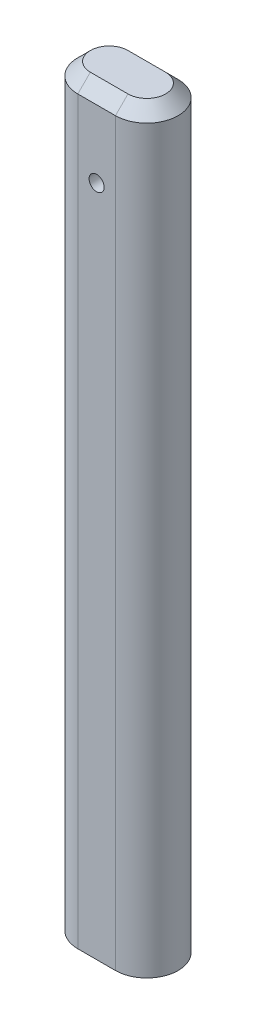
from build123d import *

# Parameters (mm, degrees)
SKETCH1_W           = 40
SKETCH1_H           = 25
BOSS_EXTRUDE1_DEPTH = 300
FILLET1_RADIUS      = 12.5
FILLET1_LENGTH      = 300
FILLET2_RADIUS      = 12.5
FILLET2_LENGTH      = 300
CHAMFER1_SIZE       = 5
SKETCH3_R           = 3
CUT_EXTRUDE2_DEPTH  = 304.685692781


with BuildPart() as part:
    # Sketch1 → Boss-Extrude1 (new body)
    with BuildSketch(Plane(origin=(0, 0, 0), x_dir=(1, 0, 0), z_dir=(0, 1, 0))):
        with Locations((20, 12.5)):
            Rectangle(SKETCH1_W, SKETCH1_H)
    extrude(amount=BOSS_EXTRUDE1_DEPTH)

    # Fillet1: full round fillet: the end face becomes a half cylinder, R = half its width
    fillet1_face = Plane((40, 150, -12.5), x_dir=(0, 1, 0), z_dir=(1, 0, 0))  # on the end face: x along it, z out of the body
    fillet1_slab = fillet1_face.offset(-FILLET1_RADIUS / 2) * Box(FILLET1_LENGTH, 2 * FILLET1_RADIUS, FILLET1_RADIUS, mode=Mode.PRIVATE)  # the body's end, R deep
    fillet1_round = Plane((27.5, 150, -12.5), x_dir=(1, 0, 0), z_dir=(0, 1, 0)) * Cylinder(FILLET1_RADIUS, FILLET1_LENGTH, mode=Mode.PRIVATE)  # its axis R under the face
    add(fillet1_slab - fillet1_round, mode=Mode.SUBTRACT)

    # Fillet2: full round fillet: the end face becomes a half cylinder, R = half its width
    fillet2_face = Plane((0, 150, -12.5), x_dir=(0, 1, 0), z_dir=(-1, 0, 0))  # on the end face: x along it, z out of the body
    fillet2_slab = fillet2_face.offset(-FILLET2_RADIUS / 2) * Box(FILLET2_LENGTH, 2 * FILLET2_RADIUS, FILLET2_RADIUS, mode=Mode.PRIVATE)  # the body's end, R deep
    fillet2_round = Plane((12.5, 150, -12.5), x_dir=(-1, 0, 0), z_dir=(0, 1, 0)) * Cylinder(FILLET2_RADIUS, FILLET2_LENGTH, mode=Mode.PRIVATE)  # its axis R under the face
    add(fillet2_slab - fillet2_round, mode=Mode.SUBTRACT)

    # Chamfer1
    chamfer1_edges = [part.edges().sort_by_distance(p)[0] for p in [
        (20, 300, -25),
        (40, 300, -12.5),
        (20, 300, 0),
        (0, 300, -12.5),
    ]]
    chamfer(chamfer1_edges, length=CHAMFER1_SIZE)

    # Sketch3 → Cut-Extrude2 (cut, through all)
    with BuildSketch(Plane.XY):
        with Locations((20, 268)):
            Circle(SKETCH3_R)
    extrude(amount=-CUT_EXTRUDE2_DEPTH, mode=Mode.SUBTRACT)


solid = part.part
